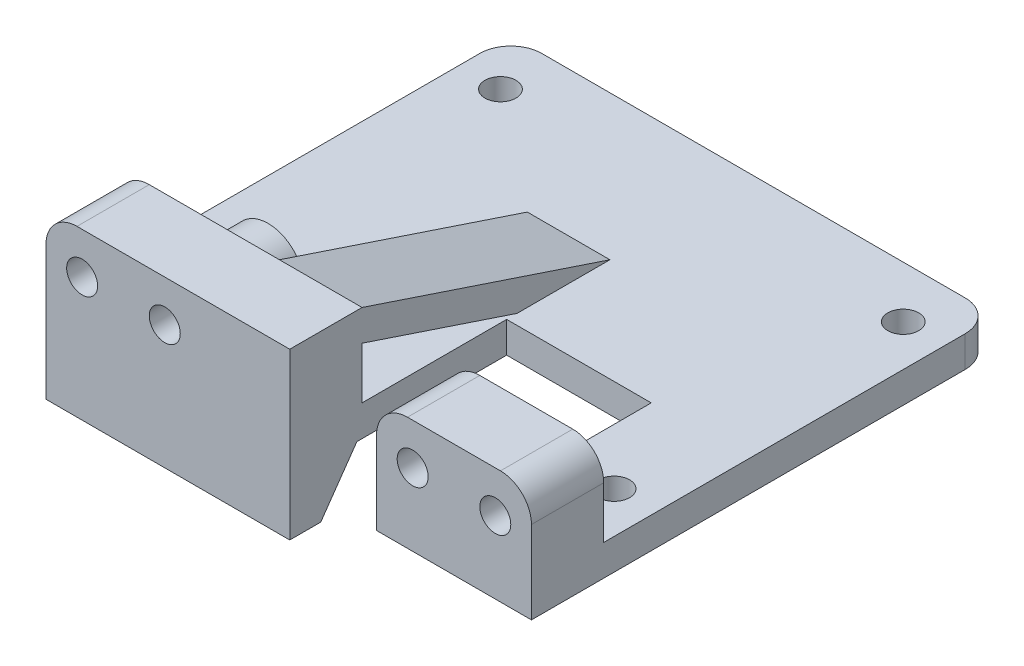
from build123d import *
from build123d.topology import SkipClean

# Parameters (mm, degrees)
SKETCH_1_R      = 1.5
EXTRUDE_1_DEPTH = 3
SKETCH_2_W      = 23.5
SKETCH_2_H      = 11
SKETCH_2_R      = 1.5
SKETCH_2_W_2    = 0.1
SKETCH_2_W_3    = 15
EXTRUDE_2_DEPTH = 7
EXTRUDE_3_DEPTH = 8
FILLET_4_R      = 3
EXTRUDE_4_DEPTH = 23.6
FILLET_5_R      = 5
FILLET_6_R      = 3
EXTRUDE_START   = 3
SKETCH_7_R      = 3.5
SKETCH_7_R_2    = 1.5
EXTRUDE_5_DEPTH = 3


with BuildPart() as part:
    # 草图1 → 凸台-拉伸1 (new body)
    with BuildSketch(Plane(origin=(0, 0, 0), x_dir=(1, 0, 0), z_dir=(0, 1, 0))):
        Polygon((-23.5, 19), (-23.5, -19), (0.1, -19), (0.1, -5), (14.1, -5), (14.1, -19), (23.5, -19), (23.5, 19), align=None)
        with Locations(Location((-19.5, -14, 0), (0, 0, 270))):
            Circle(SKETCH_1_R, mode=Mode.SUBTRACT)
        with Locations(Location((19.5, -14, 0), (0, 0, 270))):
            Circle(SKETCH_1_R, mode=Mode.SUBTRACT)
        with Locations(Location((-19.5, 14, 0), (0, 0, 270))):
            Circle(SKETCH_1_R, mode=Mode.SUBTRACT)
        with Locations(Location((19.5, 14, 0), (0, 0, 270))):
            Circle(SKETCH_1_R, mode=Mode.SUBTRACT)
    extrude(amount=EXTRUDE_1_DEPTH)

    # 草图2 → 凸台-拉伸2 (add)
    # profile 1 of 3: a face of its own
    with BuildSketch(Plane.XY.offset(19)):
        with Locations((-11.75, 5.5)):
            Rectangle(SKETCH_2_W, SKETCH_2_H)
        with Locations((-20, 7)):
            Circle(SKETCH_2_R, mode=Mode.SUBTRACT)
        with Locations((-12, 7)):
            Circle(SKETCH_2_R, mode=Mode.SUBTRACT)
    # profile 2 of 3: a face of its own
    with BuildSketch(Plane.XY.offset(19)):
        with Locations((0.05, 5.5)):
            Rectangle(SKETCH_2_W_2, SKETCH_2_H)
    # profile 3 of 3: a face of its own
    with BuildSketch(Plane.XY.offset(19)):
        with Locations((16, 5.5)):
            Rectangle(SKETCH_2_W_3, SKETCH_2_H)
        with Locations((12, 7)):
            Circle(SKETCH_2_R, mode=Mode.SUBTRACT)
        with Locations((20, 7)):
            Circle(SKETCH_2_R, mode=Mode.SUBTRACT)
    extrude(amount=EXTRUDE_2_DEPTH)

    # 草图3 → 凸台-拉伸3 (add)
    with BuildSketch(Plane(origin=(0.1, 0, 0), x_dir=(0, 0, -1), z_dir=(1, 0, 0))):
        Polygon((-19, 11), (-19, 8), (-4, 3), (5, 3), align=None)
    extrude(amount=-EXTRUDE_3_DEPTH)

    # 圆角4
    fillet_4_edges = [part.edges().sort_by_distance(p)[0] for p in [
        (-23.5, 11, 22.5),
        (23.5, 11, 22.5),
        (8.5, 11, 22.5),
    ]]
    fillet(fillet_4_edges, radius=FILLET_4_R)

    # 草图4 → 凸台-拉伸4 (add)
    with BuildSketch(Plane.ZY.offset(23.5)):
        Polygon((26, 0), (26, -5), (23, -5), (19.5, 0), align=None)
    extrude(amount=-EXTRUDE_4_DEPTH)

    # 圆角5
    fillet_5_edges = [part.edges().sort_by_distance(p)[0] for p in [
        (14.1, 1.5, 19),
    ]]
    fillet(fillet_5_edges, radius=FILLET_5_R)

    # 圆角6
    fillet_6_edges = [part.edges().sort_by_distance(p)[0] for p in [
        (-23.5, 1.5, -19),
        (23.5, 1.5, -19),
    ]]
    fillet(fillet_6_edges, radius=FILLET_6_R)

    # 草图7 → 凸台-拉伸5 (add)
    with SkipClean():  # the faces are left unmerged after this step: merging them gives an invalid solid
        with BuildSketch(Plane(origin=(0, 0, 19), x_dir=(-1, 0, 0), z_dir=(0, 0, -1)).offset(EXTRUDE_START)):
            with Locations(Location((12, 7, 0), (0, 0, 180))):
                Circle(SKETCH_7_R)
            with Locations((12, 7)):
                Circle(SKETCH_7_R_2, mode=Mode.SUBTRACT)
        extrude(amount=-EXTRUDE_5_DEPTH)


solid = part.part
